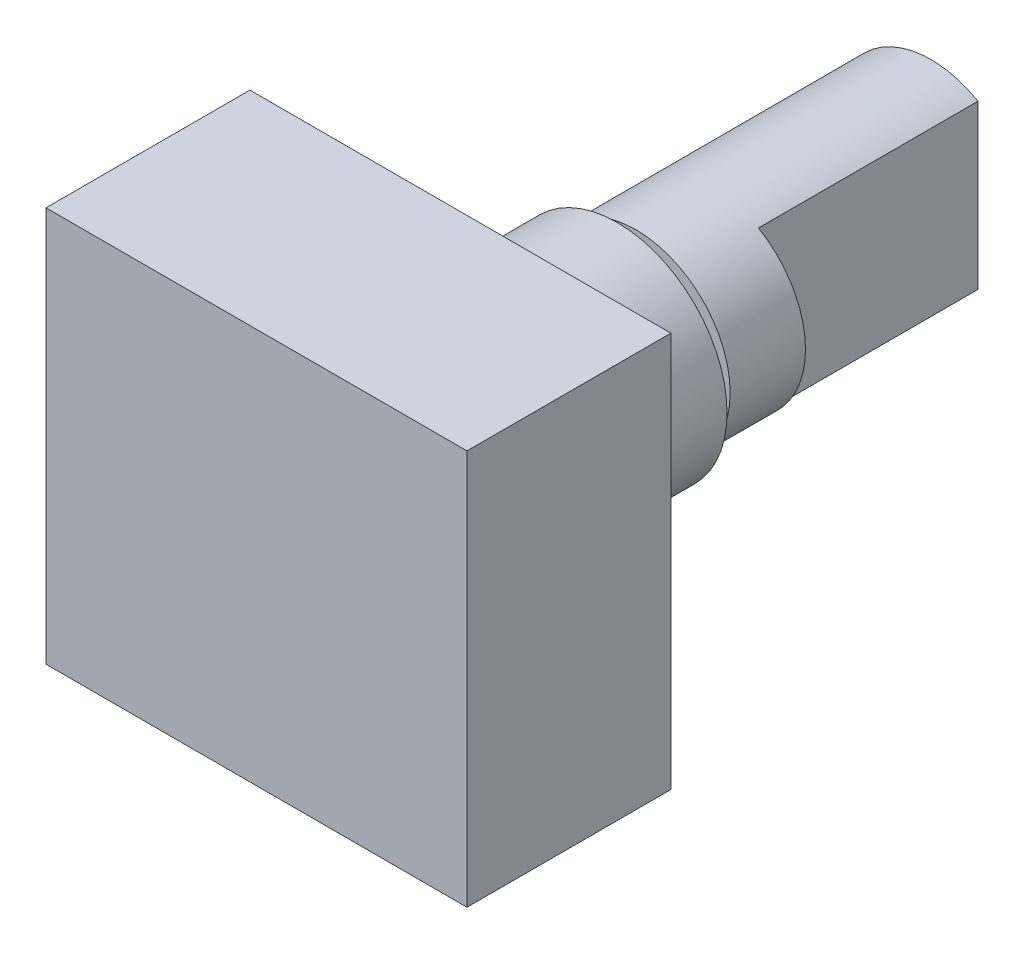
from build123d import *

# Parameters (mm, degrees)
SKETCH1_W               = 13.42
SKETCH1_H               = 12.6
BOSS_EXTRUDE1_DEPTH     = 6.5
CUT_EXTRUDE1_DEPTH      = 18.598695974
CUT_EXTRUDE1_DEPTH_BACK = 18.598695974
SKETCH4_W               = 1.5
SKETCH4_H               = 7


with BuildPart() as part:
    # Sketch1 → Boss-Extrude1 (new body)
    with BuildSketch(Plane.XY):
        Rectangle(SKETCH1_W, SKETCH1_H)
    extrude(amount=BOSS_EXTRUDE1_DEPTH)

    # Sketch3 → Revolve1 (revolve)
    with BuildSketch(Plane(origin=(0, 0, 0), x_dir=(1, 0, 0), z_dir=(0, 1, 0))):
        Polygon((0, 0), (3.5, 0), (3.5, 5), (2.063862247, 5), (2.063862247, 5.599280985), (3, 5.599280985), (3, 15), (0, 15), align=None)
    revolve(axis=Axis((0, 0, 0), (0, 0, -1)))

    # Sketch4 → Cut-Extrude1 (cut, two sides: drawn at the far end of the back side and taken through both)
    with BuildSketch(Plane(origin=(0, 0, 0), x_dir=(1, 0, 0), z_dir=(0, 1, 0)).offset(-CUT_EXTRUDE1_DEPTH_BACK)):
        with Locations((2.25, 11.5)):
            Rectangle(SKETCH4_W, SKETCH4_H)
    extrude(amount=CUT_EXTRUDE1_DEPTH + CUT_EXTRUDE1_DEPTH_BACK, mode=Mode.SUBTRACT)


solid = part.part
